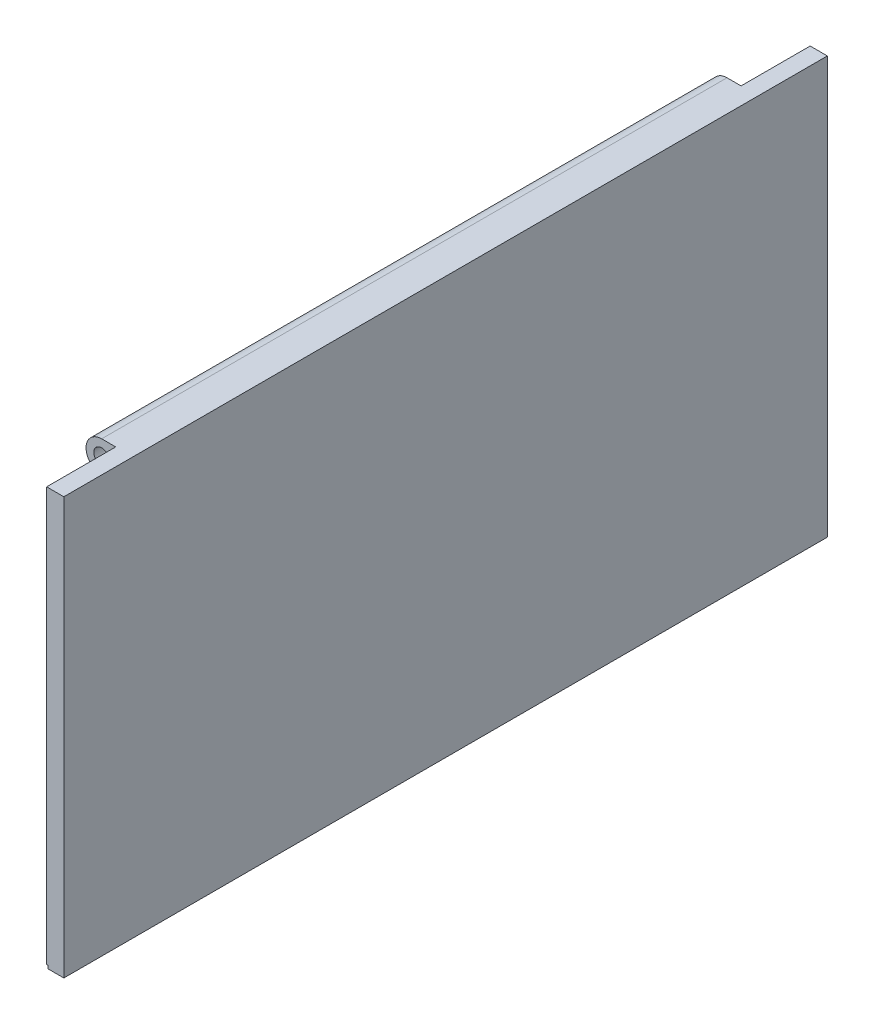
from build123d import *

# Parameters (mm, degrees)
SCHIZZO4_R                   = 2.5
SCHIZZO4_R_2                 = 1.25
ESTRUSIONE_ESTRUSIONE3_DEPTH = 100
ESTRUSIONE_ESTRUSIONE4_DEPTH = 61.05
SCHIZZO6_W                   = 8.237008172
SCHIZZO6_H                   = 5.970383375
TAGLIO_ESTRUSIONE2_DEPTH     = 119.1
SCHIZZO7_W                   = 6.014694103
SCHIZZO7_H                   = 5.674261039
TAGLIO_ESTRUSIONE3_DEPTH     = 119.1
ESTRUSIONE_ESTRUSIONE5_REACH = 140.017
SCHIZZO8_W                   = 2.75
SCHIZZO8_H                   = 66.15
TAGLIO_ESTRUSIONE4_DEPTH     = 300
RACCORDO1_R                  = 2


with BuildPart() as part:
    # Schizzo4 → Estrusione-Estrusione3 (new body)
    with BuildSketch(Plane.XY):
        Circle(SCHIZZO4_R)
        Circle(SCHIZZO4_R_2, mode=Mode.SUBTRACT)
    extrude(amount=ESTRUSIONE_ESTRUSIONE3_DEPTH)

    # Schizzo5 → Estrusione-Estrusione4 (add, symmetric)
    with BuildSketch(Plane.XY.offset(50)):
        with BuildLine():
            Line((0, 2.5), (5, 2.5))
            Line((5, 2.5), (5, -64.15))
            Line((5, -64.15), (2.5, -64.15))
            Line((2.5, -64.15), (2.5, -2.5))
            Line((2.5, -2.5), (0, -2.5))
            ThreePointArc((0, -2.5), (2.5, 0), (0, 2.5))
        make_face()
    extrude(amount=ESTRUSIONE_ESTRUSIONE4_DEPTH, both=True)

    # Schizzo6 → Taglio-Estrusione2 (cut)
    with BuildSketch(Plane(origin=(0, 0, 0), x_dir=(-1, 0, 0), z_dir=(0, 0, -1))):
        with Locations((1.618504086, 0.485191688)):
            Rectangle(SCHIZZO6_W, SCHIZZO6_H)
    extrude(amount=TAGLIO_ESTRUSIONE2_DEPTH, mode=Mode.SUBTRACT)

    # Schizzo7 → Taglio-Estrusione3 (cut)
    with BuildSketch(Plane.XY.offset(100)):
        with Locations((-0.507347052, 0.33713052)):
            Rectangle(SCHIZZO7_W, SCHIZZO7_H)
    extrude(amount=TAGLIO_ESTRUSIONE3_DEPTH, mode=Mode.SUBTRACT)

    # Estrusione-Estrusione5: up to this face of the body (flat: up to its plane)
    estrusione_estrusione5_end = Plane(part.part.faces().sort_by_distance((3.75, -30.825, -11.05))[0])
    # Schizzo8 → Estrusione-Estrusione5 (add, up to the picked face)
    with BuildSketch(Plane.XY.offset(111.05), mode=Mode.PRIVATE) as estrusione_estrusione5_sk1:
        with Locations((3.625, -30.575)):
            Rectangle(SCHIZZO8_W, SCHIZZO8_H)
    estrusione_estrusione5_tool1 = split(extrude(estrusione_estrusione5_sk1.sketch, amount=-ESTRUSIONE_ESTRUSIONE5_REACH, mode=Mode.PRIVATE), bisect_by=estrusione_estrusione5_end, keep=Keep.BOTH, mode=Mode.PRIVATE)
    add(estrusione_estrusione5_tool1.solids().sort_by(Axis((3.625, -30.575, 111.05), (0, 0, -1)))[0])

    # Schizzo9 → Taglio-Estrusione4 (cut)
    with BuildSketch(Plane.XY.offset(100)):
        Polygon((2.25, -2.5), (2.25, -1.883948392), (1.619804847, -2.5), align=None)
    extrude(amount=-TAGLIO_ESTRUSIONE4_DEPTH, mode=Mode.SUBTRACT)

    # Raccordo1
    raccordo1_edges = [part.edges().sort_by_distance(p)[0] for p in [
        (1.619804847, -2.5, 50),
    ]]
    fillet(raccordo1_edges, radius=RACCORDO1_R)


solid = part.part
